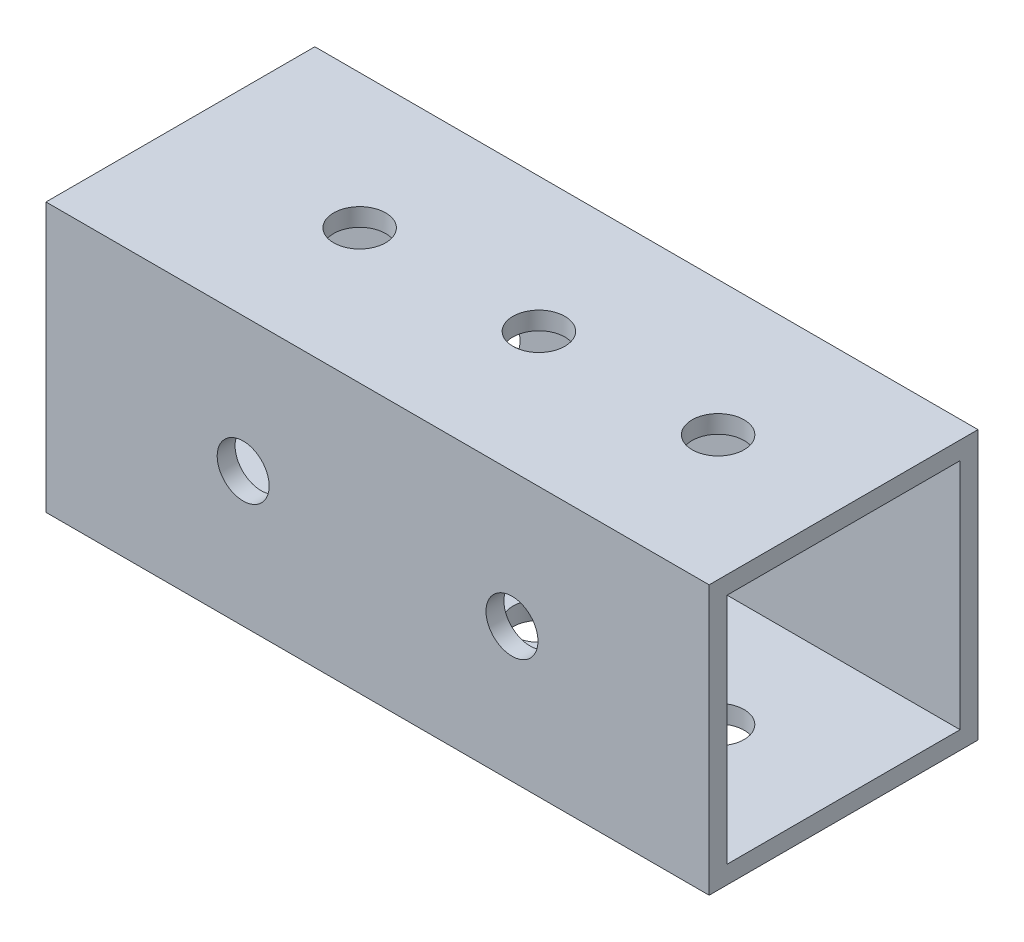
from build123d import *

# Parameters (mm, degrees)
SKETCH_1_W          = 15
SKETCH_1_H          = 15
SKETCH_1_W_2        = 13
SKETCH_1_H_2        = 13
EXTRUDE_1_DEPTH     = 37
SKETCH_2_R          = 1.45
CUT_EXTRUDE_1_DEPTH = 41.623269194
SKETCH_3_R          = 1.45
CUT_EXTRUDE_2_DEPTH = 41.623269194


with BuildPart() as part:
    # 草图1 → 凸台-拉伸1 (new body)
    with BuildSketch(Plane(origin=(0, 0, 0), x_dir=(0, 0, -1), z_dir=(1, 0, 0))):
        Rectangle(SKETCH_1_W, SKETCH_1_H)
        Rectangle(SKETCH_1_W_2, SKETCH_1_H_2, mode=Mode.SUBTRACT)
    extrude(amount=EXTRUDE_1_DEPTH)

    # 草图2 → 切除-拉伸1 (cut, through all)
    with BuildSketch(Plane(origin=(0, 0, -7.5), x_dir=(-1, 0, 0), z_dir=(0, 0, -1))):
        with Locations((-11, 0)):
            Circle(SKETCH_2_R)
        with Locations((-26, 0)):
            Circle(SKETCH_2_R)
    extrude(amount=-CUT_EXTRUDE_1_DEPTH, mode=Mode.SUBTRACT)

    # 草图3 → 切除-拉伸2 (cut, through all)
    with BuildSketch(Plane(origin=(0, 7.5, 0), x_dir=(1, 0, 0), z_dir=(0, 1, 0))):
        with Locations(Location((10, 0, 0), (0, 0, 270))):
            Circle(SKETCH_3_R)
        with Locations(Location((30, 0, 0), (0, 0, 270))):
            Circle(SKETCH_3_R)
        with Locations(Location((20, 0, 0), (0, 0, 270))):
            Circle(SKETCH_3_R)
    extrude(amount=-CUT_EXTRUDE_2_DEPTH, mode=Mode.SUBTRACT)


solid = part.part
